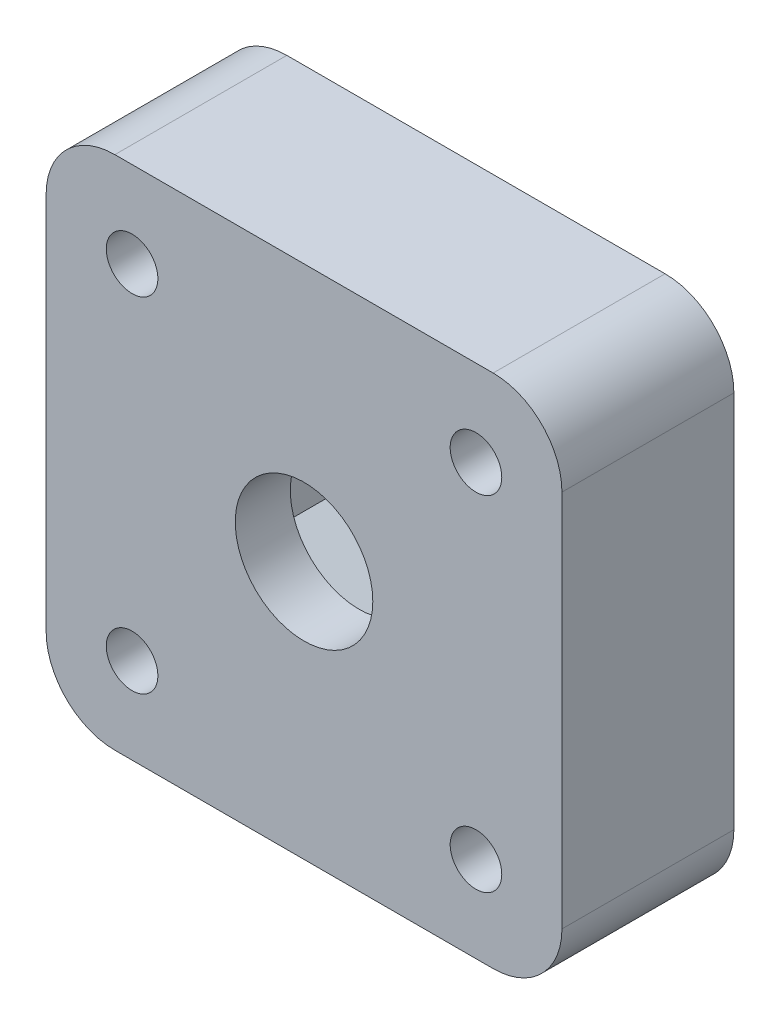
from build123d import *

# Parameters (mm, degrees)
SKETCH_1_W          = 30
SKETCH_1_H          = 30
SKETCH_1_R          = 4
SKETCH_1_R_2        = 1.5
EXTRUDE_1_DEPTH     = 10
CUT_EXTRUDE_1_DEPTH = 6.8
FILLET_1_R          = 4


with BuildPart() as part:
    # 스케치1 → 보스-돌출1 (new body)
    with BuildSketch(Plane.XY):
        Rectangle(SKETCH_1_W, SKETCH_1_H)
        Circle(SKETCH_1_R, mode=Mode.SUBTRACT)
        with Locations((-10, -10)):
            Circle(SKETCH_1_R_2, mode=Mode.SUBTRACT)
        with Locations((10, -10)):
            Circle(SKETCH_1_R_2, mode=Mode.SUBTRACT)
        with Locations((-10, 10)):
            Circle(SKETCH_1_R_2, mode=Mode.SUBTRACT)
        with Locations((10, 10)):
            Circle(SKETCH_1_R_2, mode=Mode.SUBTRACT)
    extrude(amount=EXTRUDE_1_DEPTH)

    # 스케치1<3> → 컷-돌출1 (cut)
    with BuildSketch(Plane.XY):
        Polygon((6, 3.464101615), (0, 6.92820323), (-6, 3.464101615), (-6, -3.464101615), (0, -6.92820323), (6, -3.464101615), align=None)
    extrude(amount=CUT_EXTRUDE_1_DEPTH, mode=Mode.SUBTRACT)

    # 필렛1
    fillet_1_edges = [part.edges().sort_by_distance(p)[0] for p in [
        (-15, 15, 5),
        (-15, -15, 5),
        (15, -15, 5),
        (15, 15, 5),
    ]]
    fillet(fillet_1_edges, radius=FILLET_1_R)


solid = part.part
